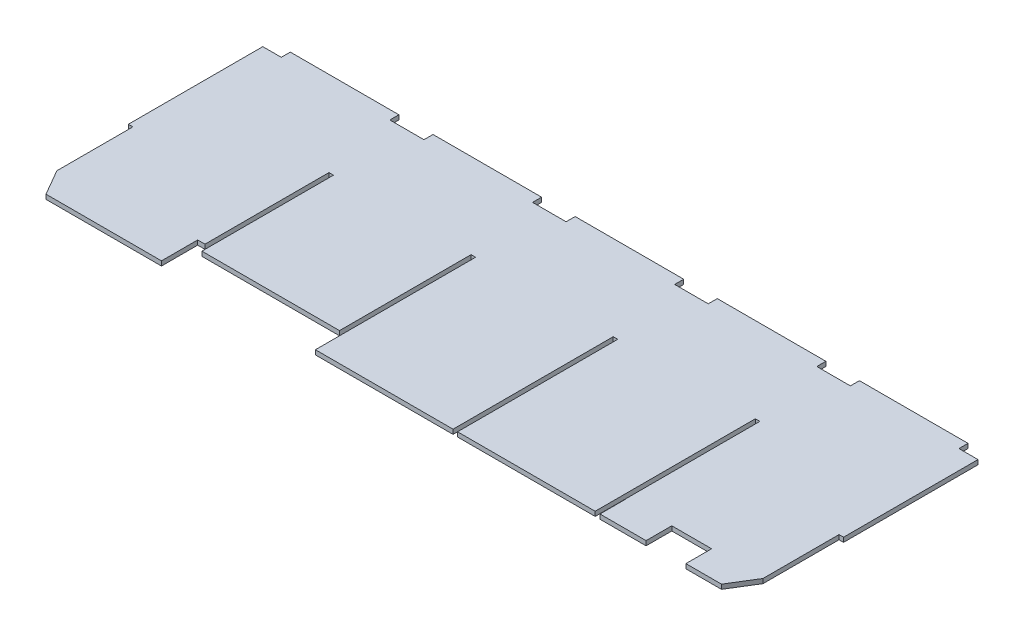
from build123d import *

# Parameters (mm, degrees)
SKETCH1_W           = 495.5921
SKETCH1_H           = 147.69846
BOSS_EXTRUDE1_DEPTH = 3.175
SKETCH2_W           = 76.2
SKETCH2_H           = 3.175
BOSS_EXTRUDE2_DEPTH = 6.35
SKETCH3_W           = 3.175
SKETCH3_H           = 188.73216
CUT_EXTRUDE1_DEPTH  = 3.175
SKETCH4_W           = 3.175
SKETCH4_H           = 94.36608
BOSS_EXTRUDE3_DEPTH = 3.175
SKETCH5_W           = 96.57842
SKETCH5_H           = 18.04416
BOSS_EXTRUDE4_DEPTH = 3.175
SKETCH6_W           = 96.577155917
SKETCH6_H           = 2.032
CUT_EXTRUDE2_DEPTH  = 523.024547982
SKETCH7_W           = 6.603370135
SKETCH7_H           = 28.867559882
CUT_EXTRUDE3_DEPTH  = 523.024547982


with BuildPart() as part:
    # Sketch1 → Boss-Extrude1 (new body)
    with BuildSketch(Plane(origin=(0, 0, 0), x_dir=(1, 0, 0), z_dir=(0, 1, 0))):
        with Locations((247.79605, 73.84923)):
            Rectangle(SKETCH1_W, SKETCH1_H)
    extrude(amount=BOSS_EXTRUDE1_DEPTH)

    # Sketch2 → Boss-Extrude2 (add)
    with BuildSketch(Plane(origin=(0, 0, -147.69846), x_dir=(-1, 0, 0), z_dir=(0, 0, -1))):
        with Locations((-447.30289, 1.5875)):
            Rectangle(SKETCH2_W, SKETCH2_H)
        with Locations((-347.54947, 1.5875)):
            Rectangle(SKETCH2_W, SKETCH2_H)
        with Locations((-247.79605, 1.5875)):
            Rectangle(SKETCH2_W, SKETCH2_H)
        with Locations((-148.04263, 1.5875)):
            Rectangle(SKETCH2_W, SKETCH2_H)
        with Locations((-47.895498166, 1.5875)):
            Rectangle(SKETCH2_W, SKETCH2_H)
    extrude(amount=BOSS_EXTRUDE2_DEPTH)

    # Sketch3 → Cut-Extrude1 (cut)
    with BuildSketch(Plane(origin=(0, 3.175, 0), x_dir=(1, 0, 0), z_dir=(0, 1, 0))):
        with Locations((397.42618, 0)):
            Rectangle(SKETCH3_W, SKETCH3_H)
        with Locations((297.67276, 0)):
            Rectangle(SKETCH3_W, SKETCH3_H)
        with Locations((197.91934, 0)):
            Rectangle(SKETCH3_W, SKETCH3_H)
        with Locations((98.167184083, 0)):
            Rectangle(SKETCH3_W, SKETCH3_H)
    extrude(amount=-CUT_EXTRUDE1_DEPTH, mode=Mode.SUBTRACT)

    # Sketch4 → Boss-Extrude3 (add, through all)
    with BuildSketch(Plane(origin=(0, 3.175, 0), x_dir=(1, 0, 0), z_dir=(0, 1, 0))):
        with Locations((-1.5875, 100.51542)):
            Rectangle(SKETCH4_W, SKETCH4_H)
        with Locations((497.1796, 100.51542)):
            Rectangle(SKETCH4_W, SKETCH4_H)
    extrude(amount=-BOSS_EXTRUDE3_DEPTH)

    # Sketch5 → Boss-Extrude4 (add, through all)
    with BuildSketch(Plane(origin=(0, 3.175, 0), x_dir=(1, 0, 0), z_dir=(0, 1, 0))):
        with Locations((247.79605, -9.02208)):
            Rectangle(SKETCH5_W, SKETCH5_H)
        with Locations((347.54947, -9.02208)):
            Rectangle(SKETCH5_W, SKETCH5_H)
        Polygon((429.9839, -18.04416), (431.560448611, -18.04416), (431.560448611, 0), (423.633900075, 0), (399.210535917, 0), (399.210535917, -18.04416), align=None)
        Polygon((495.5921, 0), (484.468648611, -18.04416), (459.500448611, -18.04416), (459.500448611, 0), (484.468648611, 0), align=None)
        Polygon((0, 0), (10.417800633, -18.04416), (96.579684083, -18.04416), (96.579684083, 0), align=None)
    extrude(amount=-BOSS_EXTRUDE4_DEPTH)

    # Sketch6 → Cut-Extrude2 (cut, through all)
    with BuildSketch(Plane(origin=(0, 3.175, 0), x_dir=(1, 0, 0), z_dir=(0, 1, 0))):
        with Locations((148.043262041, 1.016)):
            Rectangle(SKETCH6_W, SKETCH6_H)
    extrude(amount=-CUT_EXTRUDE2_DEPTH, mode=Mode.SUBTRACT)

    # Sketch7 → Cut-Extrude3 (cut, through all)
    with BuildSketch(Plane(origin=(0, 3.175, 0), x_dir=(1, 0, 0), z_dir=(0, 1, 0))):
        with Locations((94.765629101, -7.077939941)):
            Rectangle(SKETCH7_W, SKETCH7_H)
    extrude(amount=-CUT_EXTRUDE3_DEPTH, mode=Mode.SUBTRACT)


solid = part.part
